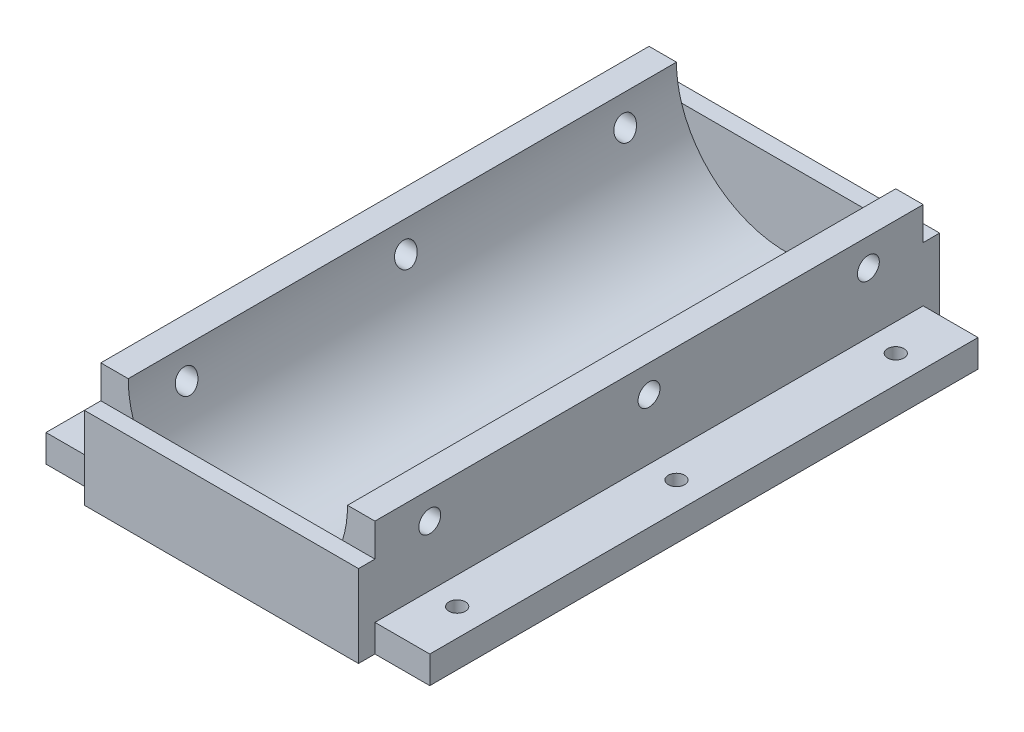
from build123d import *

# Parameters (mm, degrees)
SKETCH1_W           = 10
SKETCH1_H           = 5
BOSS_EXTRUDE2_DEPTH = 50
SKETCH2_R           = 1.5
CUT_EXTRUDE1_DEPTH  = 100
SKETCH5_R           = 2
CUT_EXTRUDE3_DEPTH  = 100
SKETCH6_W           = 50
SKETCH6_H           = 15
BOSS_EXTRUDE3_DEPTH = 3


with BuildPart() as part:
    # Sketch1 → Boss-Extrude2 (new, symmetric)
    with BuildSketch(Plane.XY):
        with BuildLine():
            ThreePointArc((-20, 0), (0, -20), (20, 0))
            Line((20, 0), (25, 0))
            Line((25, 0), (25, -21))
            Line((25, -21), (-25, -21))
            Line((-25, -21), (-25, 0))
            Line((-25, 0), (-20, 0))
        make_face()
        with Locations((-30, -18.5)):
            Rectangle(SKETCH1_W, SKETCH1_H)
        with Locations((30, -18.5)):
            Rectangle(SKETCH1_W, SKETCH1_H)
    extrude(amount=BOSS_EXTRUDE2_DEPTH, both=True)

    # Sketch2 → Cut-Extrude1 (cut)
    with BuildSketch(Plane(origin=(0, -16, 0), x_dir=(1, 0, 0), z_dir=(0, 1, 0))):
        with Locations(Location((-30, 40, 0), (0, 0, 270))):
            Circle(SKETCH2_R)
        with Locations(Location((-30, 0, 0), (0, 0, 270))):
            Circle(SKETCH2_R)
        with Locations(Location((-30, -40, 0), (0, 0, 270))):
            Circle(SKETCH2_R)
        with Locations(Location((30, 40, 0), (0, 0, 270))):
            Circle(SKETCH2_R)
        with Locations(Location((30, 0, 0), (0, 0, 270))):
            Circle(SKETCH2_R)
        with Locations(Location((30, -40, 0), (0, 0, 270))):
            Circle(SKETCH2_R)
    extrude(amount=-CUT_EXTRUDE1_DEPTH, mode=Mode.SUBTRACT)

    # Sketch5 → Cut-Extrude3 (cut)
    with BuildSketch(Plane(origin=(25, 0, 0), x_dir=(0, 0, -1), z_dir=(1, 0, 0))):
        with Locations((-40, -5)):
            Circle(SKETCH5_R)
        with Locations((0, -5)):
            Circle(SKETCH5_R)
        with Locations((40, -5)):
            Circle(SKETCH5_R)
    extrude(amount=-CUT_EXTRUDE3_DEPTH, mode=Mode.SUBTRACT)

    # Sketch6 → Boss-Extrude3 (add)
    with BuildSketch(Plane.XY.offset(50)):
        with Locations((0, -13.5)):
            Rectangle(SKETCH6_W, SKETCH6_H)
    boss_extrude3 = extrude(amount=BOSS_EXTRUDE3_DEPTH)

    # Mirror2: Boss-Extrude3 across plane
    add(boss_extrude3.mirror(Plane.XY))


solid = part.part
